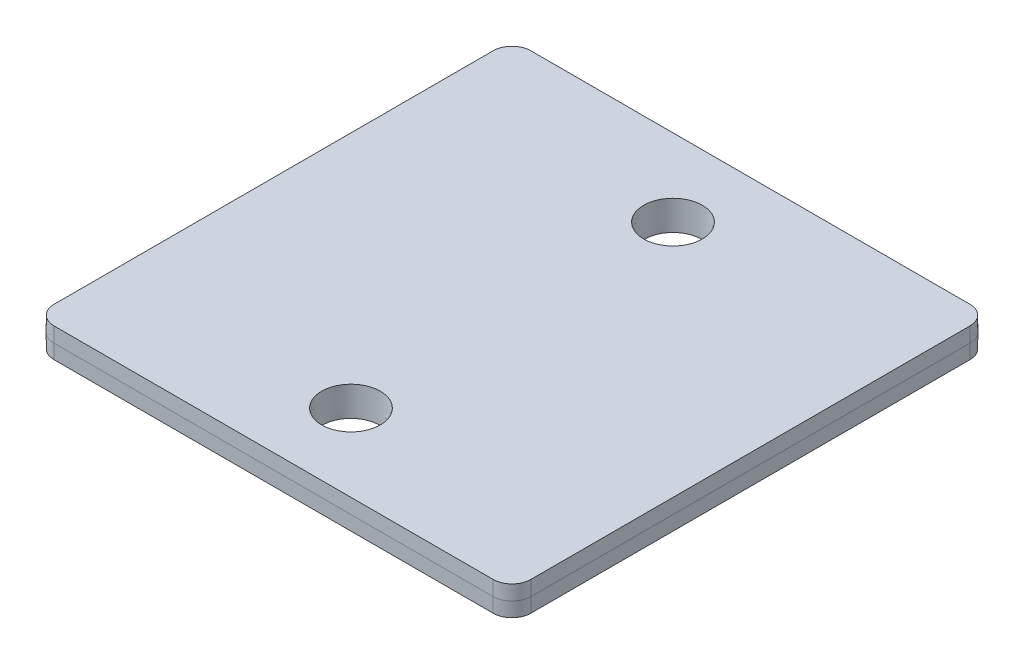
from build123d import *

# Parameters (mm, degrees)
BOSS_EXTRUDE1_DEPTH           = 0.5
BOSS_EXTRUDE1_TAPER           = 1
BOSS_EXTRUDE1_OTHER_WAY_DEPTH = 0.5
BOSS_EXTRUDE1_OTHER_WAY_TAPER = 1
SKETCH3_R                     = 1
CUT_EXTRUDE1_DEPTH            = 10
CUT_EXTRUDE1_DRAFT            = -1
CUT_EXTRUDE1_PROFILE_2_DEPTH  = 10
CUT_EXTRUDE1_PROFILE_2_DRAFT  = -1


with BuildPart() as part:
    # Sketch2 → Boss-Extrude1 (new body)
    with BuildSketch(Plane(origin=(0, 0, 0), x_dir=(1, 0, 0), z_dir=(0, 1, 0))):
        with BuildLine():
            Line((-8.149946685, 7.5), (-8.149946685, -7.5))
            ThreePointArc((-8.149946685, -7.5), (-7.959581709, -7.959581709), (-7.5, -8.149946685))
            Line((-7.5, -8.149946685), (7.5, -8.149946685))
            ThreePointArc((7.5, -8.149946685), (7.959581709, -7.959581709), (8.149946685, -7.5))
            Line((8.149946685, -7.5), (8.149946685, 7.5))
            ThreePointArc((8.149946685, 7.5), (7.959581709, 7.959581709), (7.5, 8.149946685))
            Line((7.5, 8.149946685), (-7.5, 8.149946685))
            ThreePointArc((-7.5, 8.149946685), (-7.959581709, 7.959581709), (-8.149946685, 7.5))
        make_face()
    extrude(amount=BOSS_EXTRUDE1_DEPTH, taper=BOSS_EXTRUDE1_TAPER)

    # Sketch2 → Boss-Extrude1 other way (add)
    with BuildSketch(Plane(origin=(0, 0, 0), x_dir=(1, 0, 0), z_dir=(0, 1, 0))):
        with BuildLine():
            Line((-8.149946685, 7.5), (-8.149946685, -7.5))
            ThreePointArc((-8.149946685, -7.5), (-7.959581709, -7.959581709), (-7.5, -8.149946685))
            Line((-7.5, -8.149946685), (7.5, -8.149946685))
            ThreePointArc((7.5, -8.149946685), (7.959581709, -7.959581709), (8.149946685, -7.5))
            Line((8.149946685, -7.5), (8.149946685, 7.5))
            ThreePointArc((8.149946685, 7.5), (7.959581709, 7.959581709), (7.5, 8.149946685))
            Line((7.5, 8.149946685), (-7.5, 8.149946685))
            ThreePointArc((-7.5, 8.149946685), (-7.959581709, 7.959581709), (-8.149946685, 7.5))
        make_face()
    extrude(amount=-BOSS_EXTRUDE1_OTHER_WAY_DEPTH, taper=BOSS_EXTRUDE1_OTHER_WAY_TAPER)


with BuildPart() as cut_extrude1_tool:
    # Sketch3 → Cut-Extrude1 (with draft: the straight prism first)
    with BuildSketch(Plane(origin=(0, 0.5, 0), x_dir=(1, 0, 0), z_dir=(0, 1, 0))):
        with Locations((0, 5.5)):
            Circle(SKETCH3_R)
    extrude(amount=-CUT_EXTRUDE1_DEPTH)
    # Cut-Extrude1: the draft: its side faces are tilted about the plane it starts from
    cut_extrude1_sides = [cut_extrude1_tool.faces().sort_by_distance(p)[0] for p in [
        (-1, -4.5, -5.5),
    ]]
    draft(cut_extrude1_sides, Plane(origin=(0, 0.5, 0), x_dir=(1, 0, 0), z_dir=(0, 1, 0)), CUT_EXTRUDE1_DRAFT)


with BuildPart() as part_1:
    add(part.part)

    # Cut-Extrude1: cut by cut_extrude1_tool
    add(cut_extrude1_tool.part, mode=Mode.SUBTRACT)


with BuildPart() as cut_extrude1_profile_2_tool:
    # Sketch3 → Cut-Extrude1 profile 2 (with draft: the straight prism first)
    with BuildSketch(Plane(origin=(0, 0.5, 0), x_dir=(1, 0, 0), z_dir=(0, 1, 0))):
        with Locations((0, -5.5)):
            Circle(SKETCH3_R)
    extrude(amount=-CUT_EXTRUDE1_PROFILE_2_DEPTH)
    # Cut-Extrude1 profile 2: the draft: its side faces are tilted about the plane it starts from
    cut_extrude1_profile_2_sides = [cut_extrude1_profile_2_tool.faces().sort_by_distance(p)[0] for p in [
        (-1, -4.5, 5.5),
    ]]
    draft(cut_extrude1_profile_2_sides, Plane(origin=(0, 0.5, 0), x_dir=(1, 0, 0), z_dir=(0, 1, 0)), CUT_EXTRUDE1_PROFILE_2_DRAFT)


with BuildPart() as part_2:
    add(part_1.part)

    # Cut-Extrude1 profile 2: cut by cut_extrude1_profile_2_tool
    add(cut_extrude1_profile_2_tool.part, mode=Mode.SUBTRACT)


solid = part_2.part
